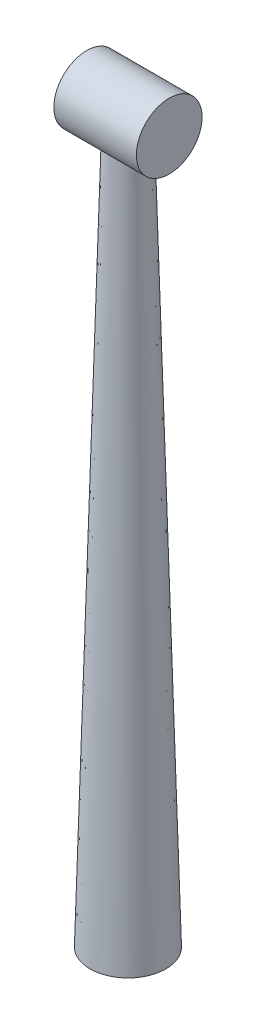
from build123d import *

# Parameters (mm, degrees)
SKETCH_1_R      = 3.985
EXTRUDE_1_DEPTH = 10


with BuildPart() as part:
    # 草图1 → 凸台-拉伸1 (new body)
    with BuildSketch(Plane(origin=(0, 0, 0), x_dir=(0, 0, -1), z_dir=(1, 0, 0))):
        Circle(SKETCH_1_R)
    extrude(amount=EXTRUDE_1_DEPTH)

    # 草图2 → 旋转1 (revolve)
    with BuildSketch(Plane.XY, mode=Mode.PRIVATE) as revolve_1_sk:
        Polygon((5, 0), (7.217111111, 0), (9.590014435, -87.6), (5, -87.6), align=None)
    revolve(revolve_1_sk.sketch.rotate(Axis((5, 0, 0), (0, -1, 0)), 205.728028053), axis=Axis((5, 0, 0), (0, -1, 0)))


solid = part.part
